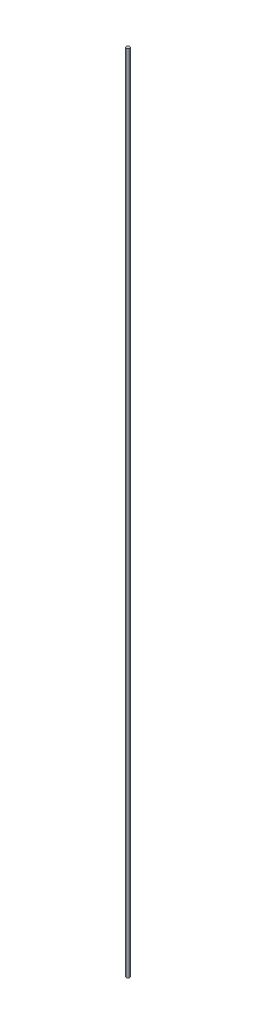
from build123d import *

# Parameters (mm, degrees)
SKETCH1_R           = 2.5
BOSS_EXTRUDE1_DEPTH = 1250


with BuildPart() as part:
    # Sketch1 → Boss-Extrude1 (new body)
    with BuildSketch(Plane(origin=(0, 0, 0), x_dir=(1, 0, 0), z_dir=(0, 1, 0))):
        with Locations(Location((0, 0, 0), (0, 0, 270))):
            Circle(SKETCH1_R)
    extrude(amount=BOSS_EXTRUDE1_DEPTH)


solid = part.part
